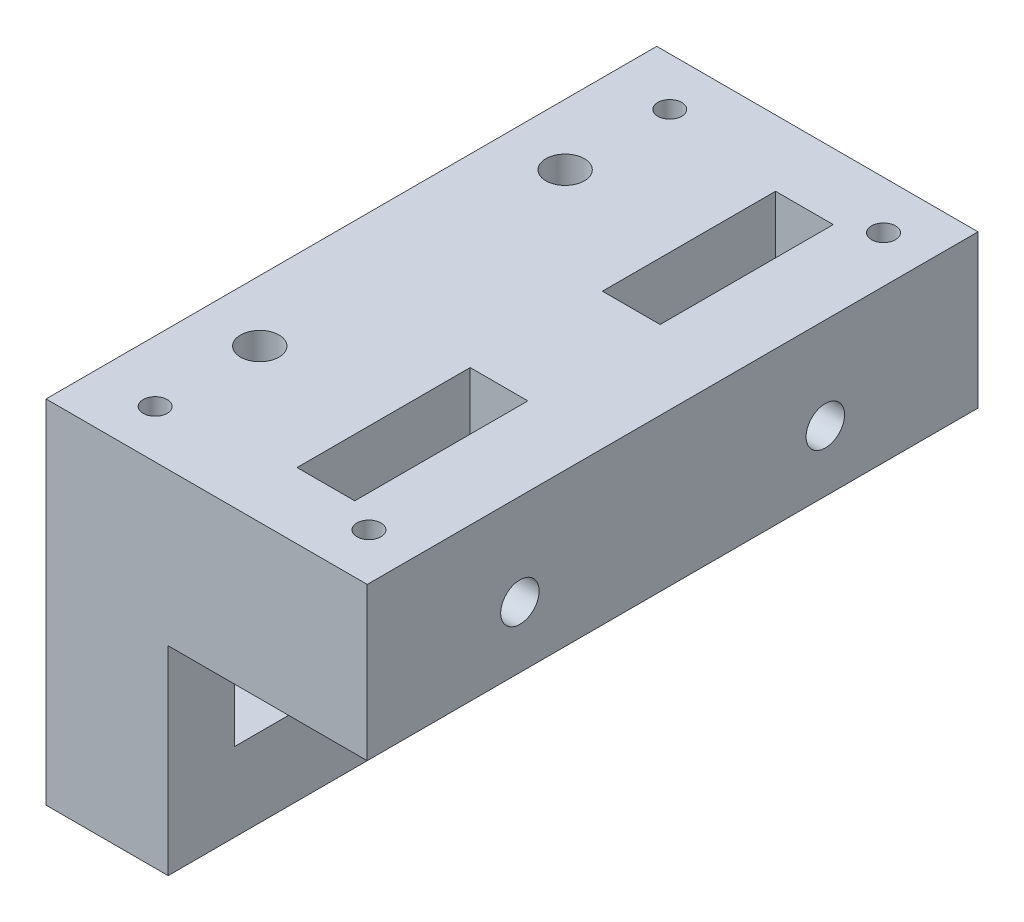
from build123d import *

# Parameters (mm, degrees)
BOSS_EXTRUDE1_DEPTH = 12.7
SKETCH2_W           = 12.7
SKETCH2_H           = 63.5
BOSS_EXTRUDE2_DEPTH = 31.75
SKETCH3_W           = 18
SKETCH3_H           = 3
CUT_EXTRUDE1_DEPTH  = 19.05
SKETCH4_R           = 2
CUT_EXTRUDE2_DEPTH  = 59.973007597
SKETCH5_R           = 2
CUT_EXTRUDE3_DEPTH  = 64.181702256
SKETCH6_W           = 63.5
SKETCH6_H           = 12.7
CUT_EXTRUDE4_DEPTH  = 11.05
SKETCH7_W           = 12.7
SKETCH7_H           = 63.5
CUT_EXTRUDE5_DEPTH  = 11.05
BOSS_EXTRUDE3_START = 3.175
SKETCH8_W           = 33.4
SKETCH8_H           = 63.5
SKETCH8_R           = 2
SKETCH8_W_2         = 6
SKETCH8_H_2         = 18
BOSS_EXTRUDE3_DEPTH = 3.175
SKETCH9_R           = 1.25
CUT_EXTRUDE6_DEPTH  = 12.7


with BuildPart() as part:
    # Sketch1 → Boss-Extrude1 (new body)
    with BuildSketch(Plane(origin=(0, 0, 0), x_dir=(1, 0, 0), z_dir=(0, 1, 0))):
        Polygon((-22.225, 31.75), (-22.225, -31.75), (0, -31.75), (0, -24.875), (-3, -24.875), (-3, -6.875), (0, -6.875), (0, 0), (0, 6.875), (-3, 6.875), (-3, 24.875), (0, 24.875), (0, 31.75), align=None)
        Polygon((0, -24.875), (0, -31.75), (22.225, -31.75), (22.225, 31.75), (0, 31.75), (0, 24.875), (3, 24.875), (3, 6.875), (0, 6.875), (0, 0), (0, -6.875), (3, -6.875), (3, -24.875), align=None)
    extrude(amount=BOSS_EXTRUDE1_DEPTH)

    # Sketch2 → Boss-Extrude2 (add)
    with BuildSketch(Plane.XZ):
        with Locations((-15.875, 0)):
            Rectangle(SKETCH2_W, SKETCH2_H)
    extrude(amount=BOSS_EXTRUDE2_DEPTH)

    # Sketch3 → Cut-Extrude1 (cut)
    with BuildSketch(Plane.ZY.offset(22.225)):
        with Locations((-15.875, -8.025)):
            Rectangle(SKETCH3_W, SKETCH3_H)
        with Locations((-15.875, -11.025)):
            Rectangle(SKETCH3_W, SKETCH3_H)
        with Locations((15.875, -8.025)):
            Rectangle(SKETCH3_W, SKETCH3_H)
        with Locations((15.875, -11.025)):
            Rectangle(SKETCH3_W, SKETCH3_H)
    extrude(amount=-CUT_EXTRUDE1_DEPTH, mode=Mode.SUBTRACT)

    # Sketch4 → Cut-Extrude2 (cut, through all)
    with BuildSketch(Plane(origin=(0, 12.7, 0), x_dir=(1, 0, 0), z_dir=(0, 1, 0))):
        with Locations(Location((-15.875, 15.875, 0), (0, 0, 270))):
            Circle(SKETCH4_R)
        with Locations(Location((-15.875, -15.875, 0), (0, 0, 270))):
            Circle(SKETCH4_R)
    extrude(amount=-CUT_EXTRUDE2_DEPTH, mode=Mode.SUBTRACT)

    # Sketch5 → Cut-Extrude3 (cut, through all)
    with BuildSketch(Plane.ZY.offset(22.225)):
        with Locations((-15.875, 6.35)):
            Circle(SKETCH5_R)
        with Locations((15.875, 6.35)):
            Circle(SKETCH5_R)
    extrude(amount=-CUT_EXTRUDE3_DEPTH, mode=Mode.SUBTRACT)

    # Sketch6 → Cut-Extrude4 (cut)
    with BuildSketch(Plane(origin=(22.225, 0, 0), x_dir=(0, 0, -1), z_dir=(1, 0, 0))):
        with Locations((0, 6.35)):
            Rectangle(SKETCH6_W, SKETCH6_H)
    extrude(amount=-CUT_EXTRUDE4_DEPTH, mode=Mode.SUBTRACT)

    # Sketch7 → Cut-Extrude5 (cut)
    with BuildSketch(Plane.XZ.offset(31.75)):
        with Locations((-15.875, 0)):
            Rectangle(SKETCH7_W, SKETCH7_H)
    extrude(amount=-CUT_EXTRUDE5_DEPTH, mode=Mode.SUBTRACT)

    # Sketch8 → Boss-Extrude3 (add)
    with BuildSketch(Plane(origin=(0, 12.7, 0), x_dir=(1, 0, 0), z_dir=(0, 1, 0)).offset(BOSS_EXTRUDE3_START)):
        with Locations((-5.525, 0)):
            Rectangle(SKETCH8_W, SKETCH8_H)
        with Locations(Location((-15.875, 15.875, 0), (0, 0, 90))):
            Circle(SKETCH8_R, mode=Mode.SUBTRACT)
        with Locations(Location((-15.875, -15.875, 0), (0, 0, 90))):
            Circle(SKETCH8_R, mode=Mode.SUBTRACT)
        with Locations((0, -15.875)):
            Rectangle(SKETCH8_W_2, SKETCH8_H_2, mode=Mode.SUBTRACT)
        with Locations((0, 15.875)):
            Rectangle(SKETCH8_W_2, SKETCH8_H_2, mode=Mode.SUBTRACT)
    extrude(amount=-BOSS_EXTRUDE3_DEPTH)

    # Sketch9 → Cut-Extrude6 (cut)
    with BuildSketch(Plane(origin=(0, 15.875, 0), x_dir=(1, 0, 0), z_dir=(0, 1, 0))):
        with Locations(Location((-15.875, 26.75, 0), (0, 0, 270))):
            Circle(SKETCH9_R)
        with Locations(Location((-15.875, -26.75, 0), (0, 0, 270))):
            Circle(SKETCH9_R)
        with Locations(Location((6.35, 26.75, 0), (0, 0, 270))):
            Circle(SKETCH9_R)
        with Locations(Location((6.35, -26.75, 0), (0, 0, 270))):
            Circle(SKETCH9_R)
    extrude(amount=-CUT_EXTRUDE6_DEPTH, mode=Mode.SUBTRACT)


solid = part.part
